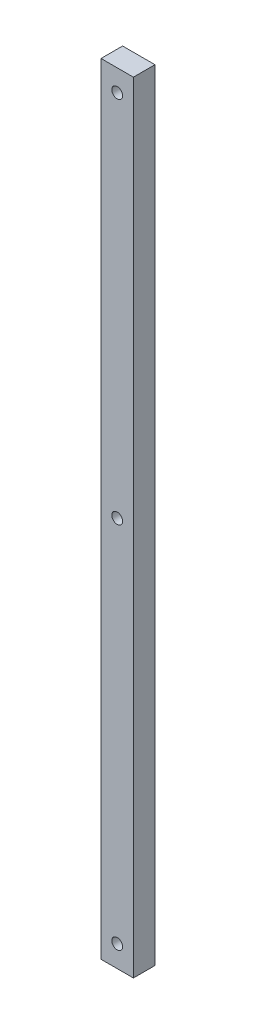
from build123d import *

# Parameters (mm, degrees)
SKETCH1_W           = 30
SKETCH1_H           = 20
BOSS_EXTRUDE1_DEPTH = 723
CUT_EXTRUDE1_DEPTH  = 25


with BuildPart() as part:
    # Sketch1 → Boss-Extrude1 (new body)
    with BuildSketch(Plane(origin=(0, 0, 0), x_dir=(1, 0, 0), z_dir=(0, 1, 0))):
        with Locations((-144.791666667, 9.583333333)):
            Rectangle(SKETCH1_W, SKETCH1_H)
    extrude(amount=BOSS_EXTRUDE1_DEPTH)

    # Sketch2 → Cut-Extrude1 (cut)
    with BuildSketch(Plane.XY.offset(0.416666667)):
        with BuildLine():
            ThreePointArc((-139.791666667, 703), (-144.791666667, 708), (-149.791666667, 703))
            Line((-149.791666667, 703), (-139.791666667, 703))
        make_face()
        with BuildLine():
            Line((-139.791666667, 703), (-149.791666667, 703))
            ThreePointArc((-149.791666667, 703), (-144.791666667, 698), (-139.791666667, 703))
        make_face()
        with BuildLine():
            ThreePointArc((-139.791666667, 361.5), (-144.791666667, 366.5), (-149.791666667, 361.5))
            Line((-149.791666667, 361.5), (-139.791666667, 361.5))
        make_face()
        with BuildLine():
            Line((-139.791666667, 361.5), (-149.791666667, 361.5))
            ThreePointArc((-149.791666667, 361.5), (-144.791666667, 356.5), (-139.791666667, 361.5))
        make_face()
        with BuildLine():
            ThreePointArc((-139.791666667, 20), (-144.791666667, 25), (-149.791666667, 20))
            Line((-149.791666667, 20), (-139.791666667, 20))
        make_face()
        with BuildLine():
            Line((-139.791666667, 20), (-149.791666667, 20))
            ThreePointArc((-149.791666667, 20), (-144.791666667, 15), (-139.791666667, 20))
        make_face()
    extrude(amount=-CUT_EXTRUDE1_DEPTH, mode=Mode.SUBTRACT)


solid = part.part
